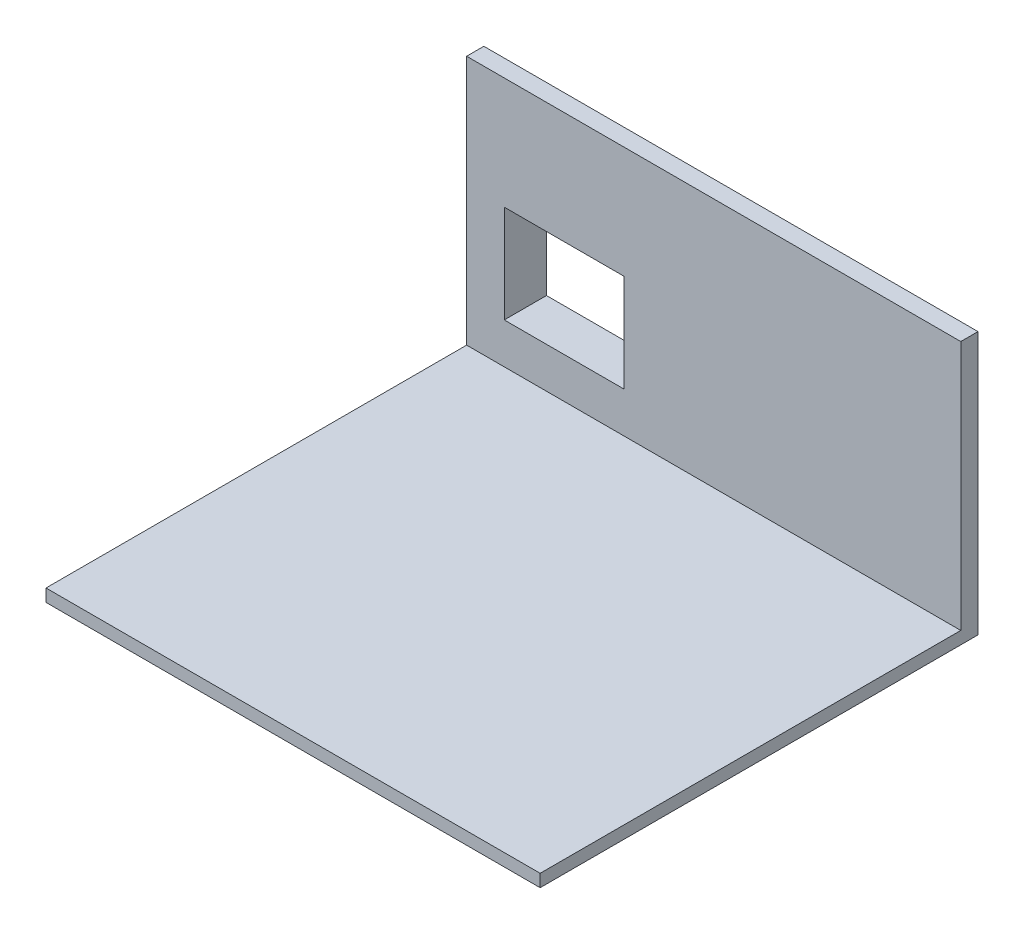
from build123d import *

# Parameters (mm, degrees)
SKETCH1_W               = 3000
SKETCH1_H               = 3500
BOSS_EXTRUDE1_DEPTH     = 100
SKETCH2_W               = 3000
SKETCH2_H               = 912.690829392
BOSS_EXTRUDE2_DEPTH     = 2000
SKETCH3_W               = 1136.531775123
SKETCH3_H               = 960.882098035
SKETCH3_W_2             = 956.531775123
SKETCH3_H_2             = 780.882098035
BOSS_EXTRUDE3_DEPTH     = 200
SKETCH4_W               = 3000
SKETCH4_H               = 2000
CUT_EXTRUDE1_DEPTH      = 775
CUT_EXTRUDE2_DEPTH      = 7465.750498175
CUT_EXTRUDE2_DEPTH_BACK = 7465.750498175
SKETCH5_W               = 956.531775123
SKETCH5_H               = 780.882098035
BOSS_EXTRUDE4_DEPTH     = 950


with BuildPart() as part:
    # Sketch1 → Boss-Extrude1 (new body)
    with BuildSketch(Plane(origin=(0, 0, 0), x_dir=(1, 0, 0), z_dir=(0, 1, 0))):
        with Locations((-4750, 10.869565217)):
            Rectangle(SKETCH1_W, SKETCH1_H)
    extrude(amount=BOSS_EXTRUDE1_DEPTH)

    # Sketch2 → Boss-Extrude2 (add)
    with BuildSketch(Plane(origin=(0, 100, 0), x_dir=(1, 0, 0), z_dir=(0, 1, 0))):
        with Locations((-4750, 1304.524150521)):
            Rectangle(SKETCH2_W, SKETCH2_H)
    extrude(amount=BOSS_EXTRUDE2_DEPTH)

    # Sketch3 → Boss-Extrude3 (add)
    with BuildSketch(Plane(origin=(0, 0, -1760.869565217), x_dir=(-1, 0, 0), z_dir=(0, 0, -1))):
        with Locations((5470.975470672, 815.25473368)):
            Rectangle(SKETCH3_W, SKETCH3_H)
        with Locations((5470.975470672, 815.25473368)):
            Rectangle(SKETCH3_W_2, SKETCH3_H_2, mode=Mode.SUBTRACT)
    extrude(amount=BOSS_EXTRUDE3_DEPTH)

    # Sketch4 → Cut-Extrude1 (cut)
    with BuildSketch(Plane.XY.offset(-848.178735825)):
        with Locations((-4750, 1100)):
            Rectangle(SKETCH4_W, SKETCH4_H)
    extrude(amount=-CUT_EXTRUDE1_DEPTH, mode=Mode.SUBTRACT)

    # Sketch5 → Cut-Extrude2 (cut, two sides: drawn at the far end of the back side and taken through both)
    with BuildSketch(Plane(origin=(0, 0, -1760.869565217), x_dir=(-1, 0, 0), z_dir=(0, 0, -1)).offset(-CUT_EXTRUDE2_DEPTH_BACK)):
        with Locations((5470.975470672, 815.25473368)):
            Rectangle(SKETCH5_W, SKETCH5_H)
    extrude(amount=CUT_EXTRUDE2_DEPTH + CUT_EXTRUDE2_DEPTH_BACK, mode=Mode.SUBTRACT)

    # Sketch6 → Boss-Extrude4 (add)
    with BuildSketch(Plane(origin=(-3250, 0, 0), x_dir=(0, 0, -1), z_dir=(1, 0, 0))):
        Polygon((1760.869565217, 0), (1760.869565217, 2100), (1623.178735825, 2100), (1623.178735825, 100), (-1739.130434783, 100), (-1739.130434783, 0), (1620.900155495, 0), (1623.178735825, 0), align=None)
    extrude(amount=BOSS_EXTRUDE4_DEPTH)


solid = part.part
